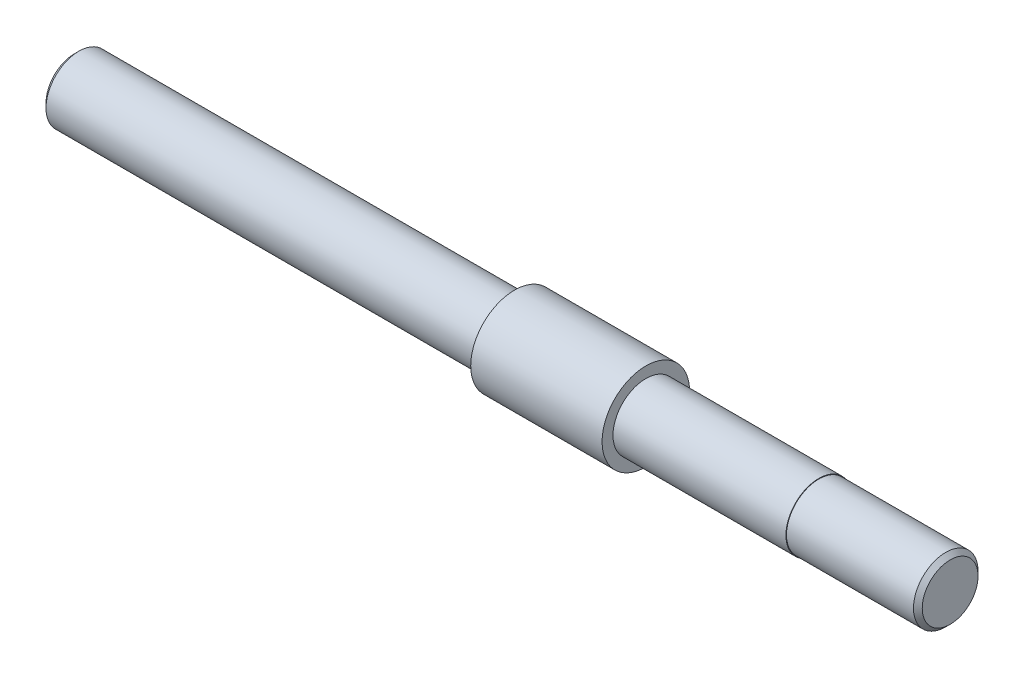
from build123d import *

# Parameters (mm, degrees)
CHAMFER_1_SIZE = 0.2


with BuildPart() as part:
    # 草图1 → 旋转1 (revolve)
    with BuildSketch(Plane.XY, mode=Mode.PRIVATE) as revolve_1_sk:
        Polygon((0, 0), (0, 1.475), (-6, 1.475), (-6, 1.5), (-13.9, 1.5), (-13.9, 2), (-19.9, 2), (-19.9, 1.5), (-40, 1.5), (-40, 0), align=None)
    revolve(revolve_1_sk.sketch.rotate(Axis((-12.088767593, 0, 0), (1, 0, 0)), 90), axis=Axis((-12.088767593, 0, 0), (1, 0, 0)))

    # 倒角1
    chamfer_1_edges = [part.edges().sort_by_distance(p)[0] for p in [
        (0, 0, -1.475),
        (-40, 0, -1.5),
    ]]
    chamfer(chamfer_1_edges, length=CHAMFER_1_SIZE)


solid = part.part
